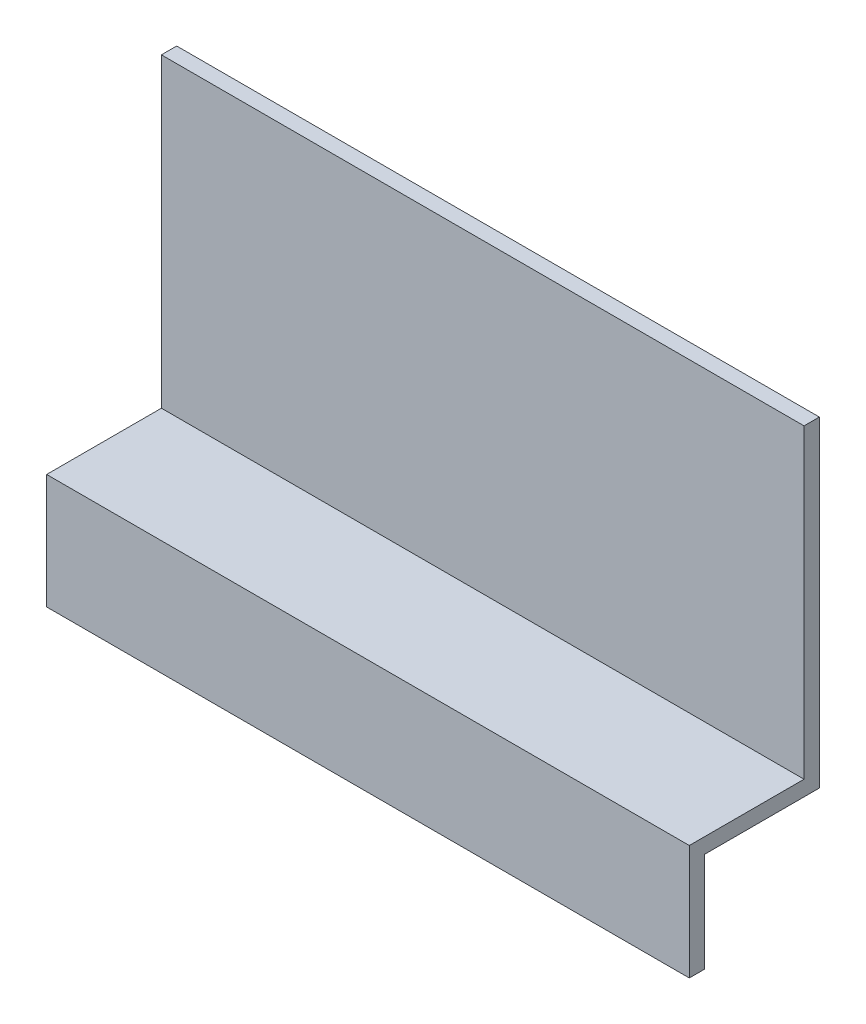
from build123d import *

# Parameters (mm, degrees)
BOSS_EXTRUDE1_DEPTH = 84


with BuildPart() as part:
    # Sketch1 → Boss-Extrude1 (new body)
    with BuildSketch(Plane(origin=(0, 0, 0), x_dir=(0, 0, -1), z_dir=(1, 0, 0))):
        Polygon((0, 0), (0, 13), (15, 13), (15, 55), (13, 55), (13, 15), (-2, 15), (-2, 0), align=None)
    extrude(amount=-BOSS_EXTRUDE1_DEPTH)


solid = part.part
